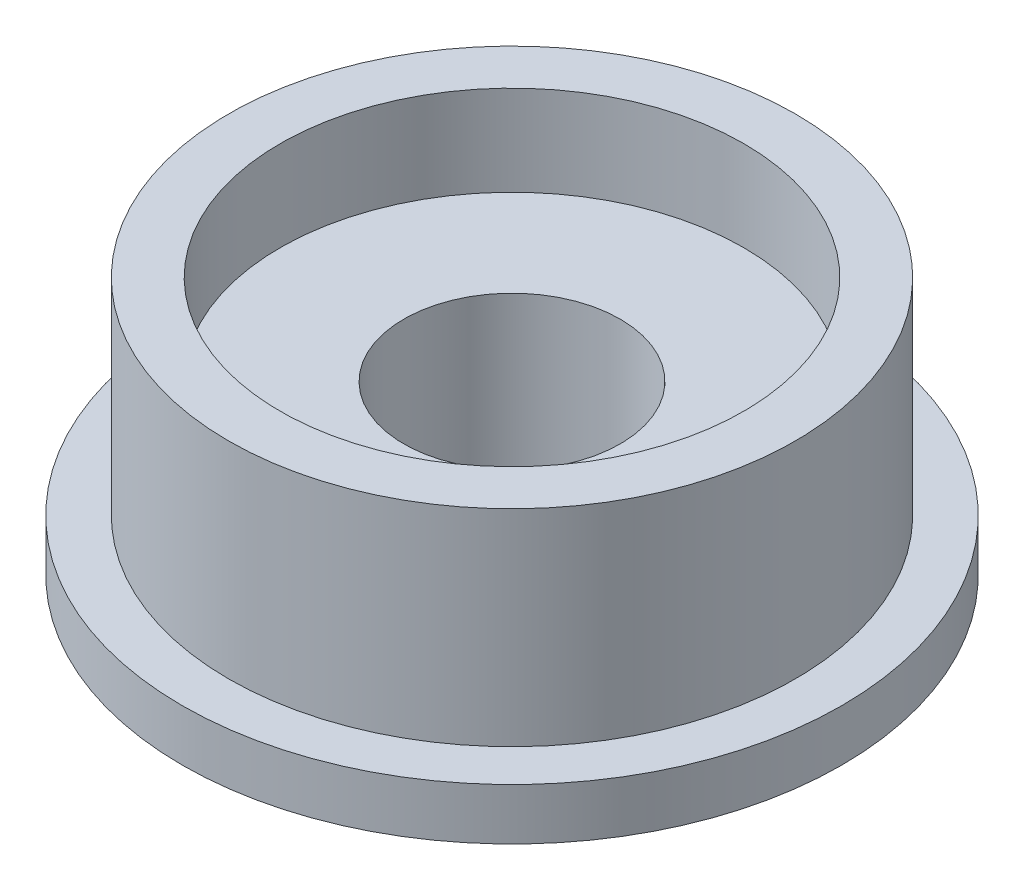
from build123d import *


with BuildPart() as part:
    # Sketch4 → Revolve1 (revolve)
    with BuildSketch(Plane.XY, mode=Mode.PRIVATE) as revolve1_sk:
        Polygon((4.2, 0), (4.2, 6.5), (9, 6.5), (9, 10), (11, 10), (11, 2), (12.8, 2), (12.8, 0), align=None)
    revolve(revolve1_sk.sketch.rotate(Axis((0, 0, 0), (0, 1, 0)), 90), axis=Axis((0, 0, 0), (0, 1, 0)))


solid = part.part
